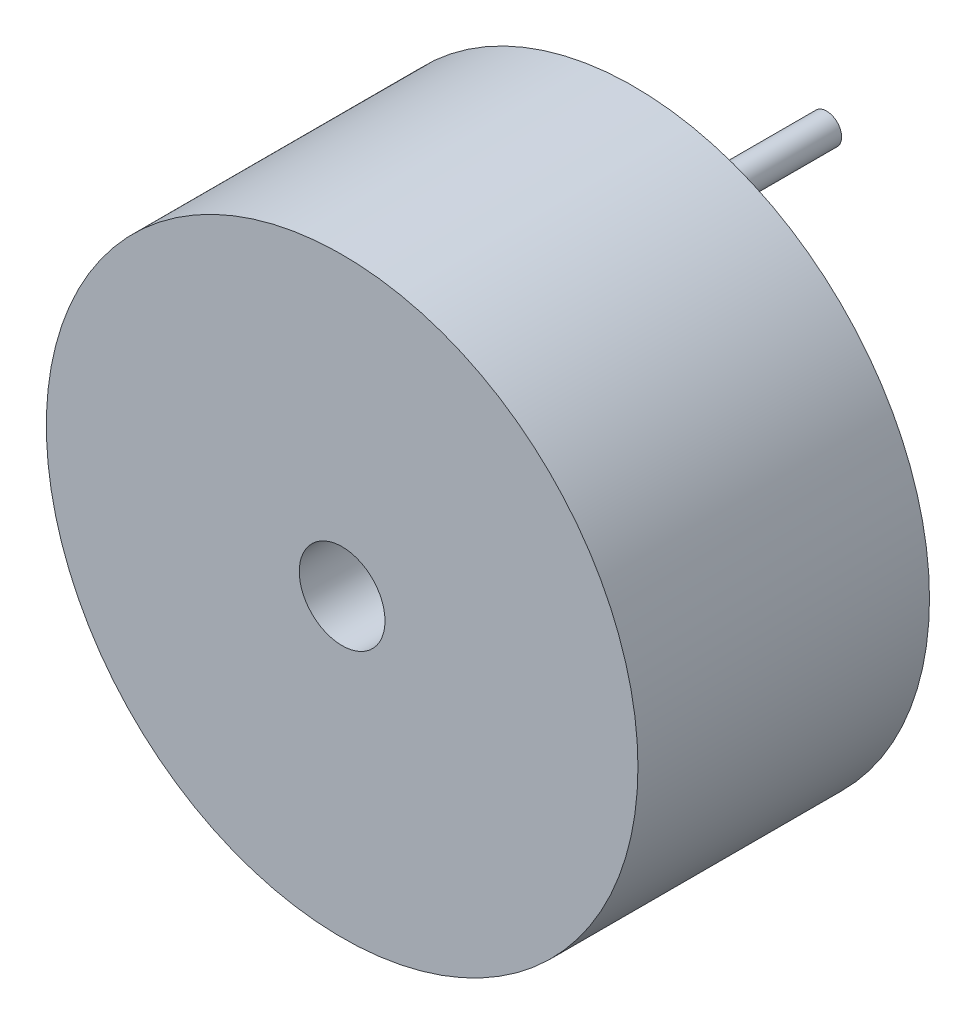
from build123d import *

# Parameters (mm, degrees)
SKETCH_1_R          = 6.9
EXTRUDE_1_DEPTH     = 6.8
SKETCH_2_R          = 0.35
EXTRUDE_2_DEPTH     = 4.5
SKETCH_3_R          = 1
CUT_EXTRUDE_1_DEPTH = 4.5


with BuildPart() as part:
    # Эскиз1 → Бобышка-Вытянуть1 (new body)
    with BuildSketch(Plane.XY):
        Circle(SKETCH_1_R)
    extrude(amount=EXTRUDE_1_DEPTH)

    # Эскиз2 → Бобышка-Вытянуть2 (add)
    with BuildSketch(Plane(origin=(0, 0, 0), x_dir=(-1, 0, 0), z_dir=(0, 0, -1))):
        with Locations(Location((0, 3.8, 0), (0, 0, 180))):
            Circle(SKETCH_2_R)
        with Locations(Location((0, -3.8, 0), (0, 0, 180))):
            Circle(SKETCH_2_R)
    extrude(amount=EXTRUDE_2_DEPTH)

    # Эскиз3 → Вырез-Вытянуть1 (cut)
    with BuildSketch(Plane.XY.offset(6.8)):
        Circle(SKETCH_3_R)
    extrude(amount=-CUT_EXTRUDE_1_DEPTH, mode=Mode.SUBTRACT)


solid = part.part
